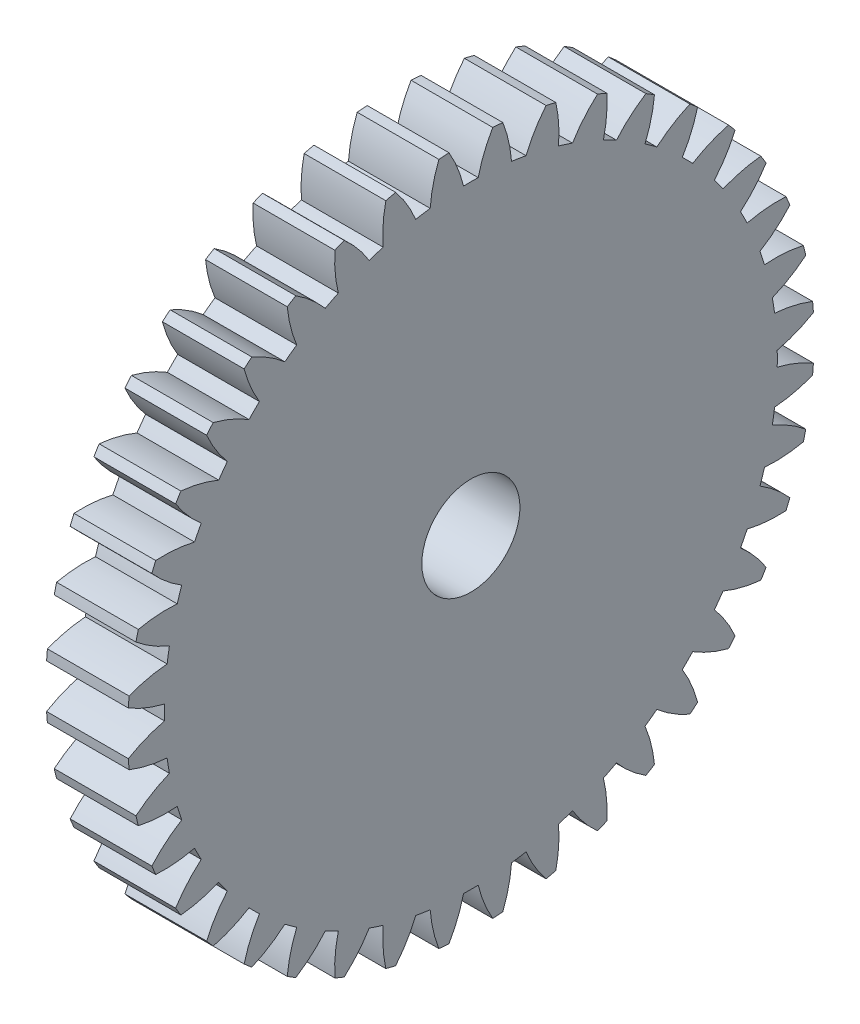
from build123d import *

# Parameters (mm, degrees)
BASPROSKE_W      = 5
BASPROSKE_H      = 21
TOOTHCUT_DEPTH   = 31.116440693
TEETHCUTS_COUNT  = 40
TEETHCUTS_ANGLE  = 351
HUBNEAONESKE_R   = 7
HUBNEARONE_DEPTH = 6.0000508
BORSKE_R         = 3
BORE_DEPTH       = 11.0000508


with BuildPart() as part:
    # BasProSke → Base-Revolve (revolve)
    with BuildSketch(Plane(origin=(0, 0, 0), x_dir=(1, 0, 0), z_dir=(0, 1, 0)), mode=Mode.PRIVATE) as base_revolve_sk:
        with Locations((2.5, 10.5)):
            Rectangle(BASPROSKE_W, BASPROSKE_H)
    revolve(base_revolve_sk.sketch.rotate(Axis((-10, 0, 0), (1, 0, 0)), 180), axis=Axis((-10, 0, 0), (1, 0, 0)))

    # TooCutSke → ToothCut (cut, through all)
    with BuildSketch(Plane(origin=(0, 0, 0), x_dir=(0, 0, -1), z_dir=(1, 0, 0))):
        with BuildLine():
            ThreePointArc((0.448673268, 18.74363074), (0, 18.749), (-0.448673268, 18.74363074))
            ThreePointArc((-0.448673268, 18.74363074), (-0.816786816, 19.89705013), (-1.354745081, 20.981708961))
            ThreePointArc((-1.354745081, 20.981708961), (0, 21.0254), (1.354745081, 20.981708961))
            ThreePointArc((1.354745081, 20.981708961), (0.816786816, 19.89705013), (0.448673268, 18.74363074))
        make_face()
    toothcut = extrude(amount=TOOTHCUT_DEPTH, mode=Mode.SUBTRACT)

    # TeethCuts: ToothCut ×40 about axis
    teethcuts_axis = Axis((-10, 0, 0), (1, 0, 0))
    for i in range(1, TEETHCUTS_COUNT):
        add(toothcut.rotate(teethcuts_axis, i * TEETHCUTS_ANGLE / (TEETHCUTS_COUNT - 1)), mode=Mode.SUBTRACT)

    # HubNeaOneSke → HubNearOne (add)
    with BuildSketch(Plane.ZY):
        with Locations(Location((0, 0, 0), (0, 0, 180))):
            Circle(HUBNEAONESKE_R)
    extrude(amount=HUBNEARONE_DEPTH)

    # BorSke → Bore (cut, symmetric)
    with BuildSketch(Plane(origin=(0, 0, 0), x_dir=(0, 0, -1), z_dir=(1, 0, 0))):
        with Locations(Location((0, 0, 0), (0, 0, 180))):
            Circle(BORSKE_R)
    extrude(amount=BORE_DEPTH, both=True, mode=Mode.SUBTRACT)


solid = part.part
